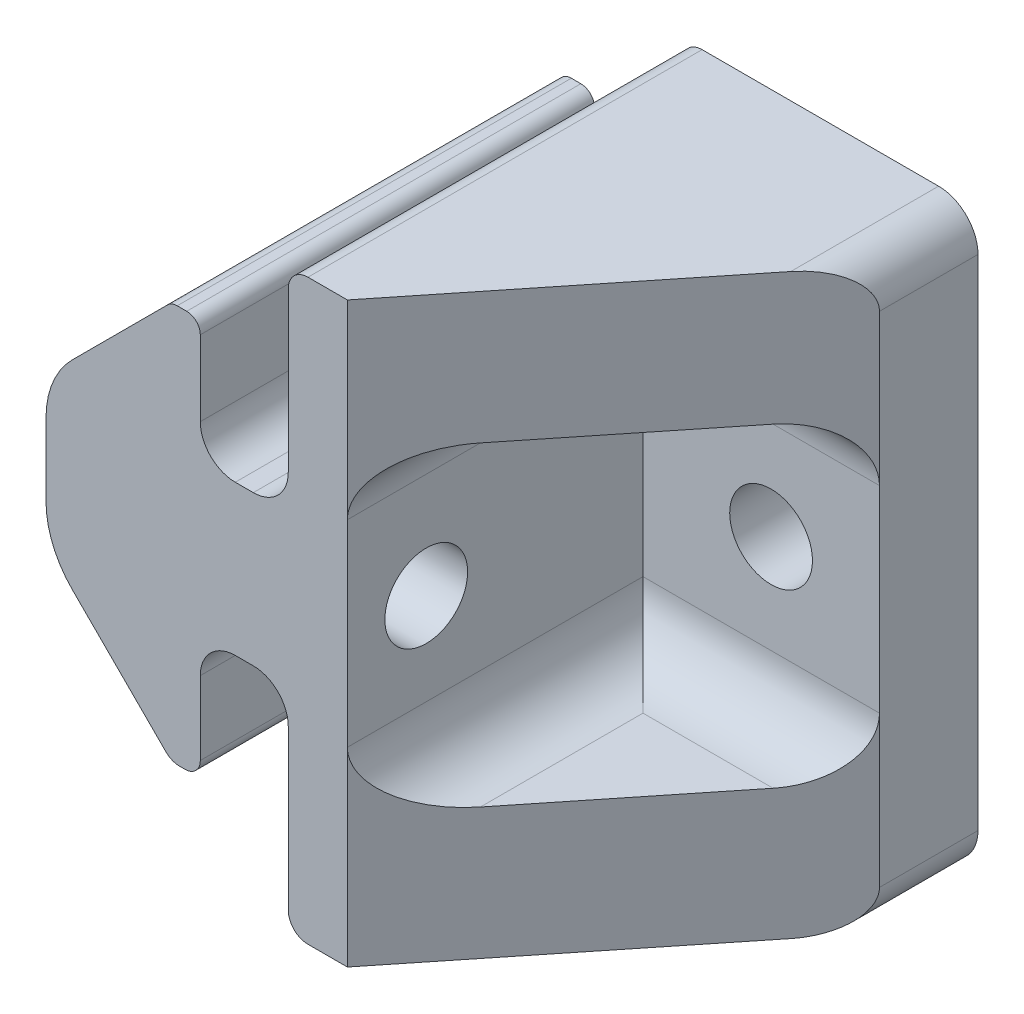
from build123d import *

# Parameters (mm, degrees)
BOSS_EXTRUDE1_DEPTH = 20
CUT_EXTRUDE5_DEPTH  = 15
SKETCH3_R           = 2.1
CUT_EXTRUDE2_DEPTH  = 43.075221209
SKETCH5_R           = 2.1
CUT_EXTRUDE4_DEPTH  = 67.161318327
CUT_EXTRUDE6_DEPTH  = 65.034014837
FILLET1_R           = 3


with BuildPart() as part:
    # Sketch1 → Boss-Extrude1 (new body)
    with BuildSketch(Plane.XY):
        with BuildLine():
            Line((38.3, 10.745623604), (38.3, 9.881410941))
            Line((38.3, 9.881410941), (38.3, 5.394343623))
            ThreePointArc((38.3, 5.394343623), (38.592893219, 4.687236842), (39.3, 4.394343623))
            Line((39.3, 4.394343623), (40.3, 4.394343623))
            Line((40.3, 4.394343623), (51.3, 4.394343623))
            ThreePointArc((51.3, 4.394343623), (52.714213562, 4.98013006), (53.3, 6.394343623))
            Line((53.3, 6.394343623), (53.3, 29.710978016))
            Line((53.3, 29.710978016), (53.3, 31.710978016))
            ThreePointArc((53.3, 31.710978016), (52.714213562, 33.125191579), (51.3, 33.710978016))
            Line((51.3, 33.710978016), (41.3, 33.710978016))
            Line((41.3, 33.710978016), (39.3, 33.710978016))
            ThreePointArc((39.3, 33.710978016), (38.592893219, 33.418084798), (38.3, 32.710978016))
            Line((38.3, 32.710978016), (38.3, 28.215588568))
            Line((38.3, 28.215588568), (38.3, 27.353495632))
            Line((38.3, 27.353495632), (38.3, 24.630195866))
            ThreePointArc((38.3, 24.630195866), (37.780173169, 23.37522288), (36.525200183, 22.855396049))
            Line((36.525200183, 22.855396049), (35.6108, 22.855396049))
            ThreePointArc((35.6108, 22.855396049), (34.355826885, 23.375222934), (33.836, 24.630196049))
            Line((33.836, 24.630196049), (33.836, 28.448))
            ThreePointArc((33.836, 28.448), (33.634196572, 28.935196572), (33.147, 29.137))
            Line((33.147, 29.137), (32.664287242, 29.137))
            ThreePointArc((32.664287242, 29.137), (32.400617966, 29.084552836), (32.177090071, 28.935195973))
            Line((32.177090071, 28.935195973), (27.33900161, 24.097095612))
            ThreePointArc((27.33900161, 24.097095612), (26.352731832, 22.621035632), (26.0064, 20.879905136))
            Line((26.0064, 20.879905136), (26.0064, 17.220094864))
            ThreePointArc((26.0064, 17.220094864), (26.352731832, 15.478964368), (27.33900161, 14.002904388))
            Line((27.33900161, 14.002904388), (32.090366071, 9.25152824))
            ThreePointArc((32.090366071, 9.25152824), (32.409953896, 9.037986056), (32.786933649, 8.963))
            Line((32.786933649, 8.963), (33.060275787, 8.963))
            ThreePointArc((33.060275787, 8.963), (33.608795638, 9.190204362), (33.836, 9.738724213))
            Line((33.836, 9.738724213), (33.836, 13.469803585))
            ThreePointArc((33.836, 13.469803585), (34.355826992, 14.724776959), (35.610800366, 15.244603951))
            Line((35.610800366, 15.244603951), (36.5252, 15.244603951))
            ThreePointArc((36.5252, 15.244603951), (37.780173115, 14.724777066), (38.3, 13.469803951))
            Line((38.3, 13.469803951), (38.3, 10.745623604))
        make_face()
    extrude(amount=-BOSS_EXTRUDE1_DEPTH)

    # Sketch6 → Cut-Extrude5 (cut)
    with BuildSketch(Plane.XY):
        Polygon((53.3, 19.05266082), (53.3, 27.05266082), (41.3, 27.05266082), (41.3, 13.469803951), (41.3, 11.05266082), (53.3, 11.05266082), align=None)
    extrude(amount=-CUT_EXTRUDE5_DEPTH, mode=Mode.SUBTRACT)

    # Sketch3 → Cut-Extrude2 (cut, through all)
    with BuildSketch(Plane(origin=(41.3, 0, 0), x_dir=(0, 0, -1), z_dir=(1, 0, 0))):
        with Locations((4, 18.710978016)):
            Circle(SKETCH3_R)
    extrude(amount=-CUT_EXTRUDE2_DEPTH, mode=Mode.SUBTRACT)

    # Sketch5 → Cut-Extrude4 (cut, through all)
    with BuildSketch(Plane(origin=(0, 0, -20), x_dir=(-1, 0, 0), z_dir=(0, 0, -1))):
        with Locations((-47.8, 19.05266082)):
            Circle(SKETCH5_R)
    extrude(amount=-CUT_EXTRUDE4_DEPTH, mode=Mode.SUBTRACT)

    # Sketch7 → Cut-Extrude6 (cut, through all)
    with BuildSketch(Plane.XZ.offset(-4.394343623)):
        Polygon((41.3, 0), (53.3, -15), (53.3, 0), align=None)
    extrude(amount=-CUT_EXTRUDE6_DEPTH, mode=Mode.SUBTRACT)

    # Fillet1
    fillet1_edges = [part.edges().sort_by_distance(p)[0] for p in [
        (41.3, 11.05266082, -7.5),
        (41.3, 27.05266082, -7.5),
        (47.3, 11.05266082, -15),
        (47.3, 27.05266082, -15),
    ]]
    fillet(fillet1_edges, radius=FILLET1_R)


solid = part.part
